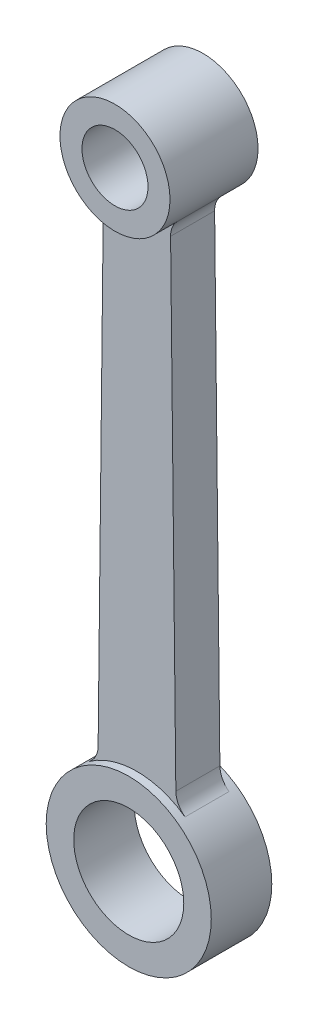
from build123d import *

# Parameters (mm, degrees)
SKETCH1_R           = 7.5
SKETCH1_R_2         = 5
BOSS_EXTRUDE1_DEPTH = 2.75
SKETCH2_R           = 5
SKETCH2_R_2         = 3
BOSS_EXTRUDE2_DEPTH = 4
BOSS_EXTRUDE3_DEPTH = 2
FILLET1_R           = 2


with BuildPart() as part:
    # Sketch1 → Boss-Extrude1 (new, symmetric)
    with BuildSketch(Plane.XY):
        Circle(SKETCH1_R)
        Circle(SKETCH1_R_2, mode=Mode.SUBTRACT)
    extrude(amount=BOSS_EXTRUDE1_DEPTH, both=True)



with BuildPart() as body_2:
    # Sketch2 → Boss-Extrude2 (new, symmetric)
    with BuildSketch(Plane.XY):
        with Locations((0, 56)):
            Circle(SKETCH2_R)
        with Locations((0, 56)):
            Circle(SKETCH2_R_2, mode=Mode.SUBTRACT)
    extrude(amount=BOSS_EXTRUDE2_DEPTH, both=True)


with BuildPart() as part_1:
    add(part.part)

    add(body_2.part)  # Boss-Extrude3 merges body 2
    # Sketch3 → Boss-Extrude3 (add, symmetric)
    with BuildSketch(Plane.XY):
        with BuildLine():
            Line((-3.043800059, 52.033227861), (-3.543272067, 6.610236233))
            ThreePointArc((-3.543272067, 6.610236233), (0, 7.5), (3.543272067, 6.610236233))
            Line((3.543272067, 6.610236233), (3.043800059, 52.033227861))
            ThreePointArc((3.043800059, 52.033227861), (0, 51), (-3.043800059, 52.033227861))
        make_face()
    extrude(amount=BOSS_EXTRUDE3_DEPTH, both=True)

    # Fillet1
    fillet1_edges = [part_1.edges().sort_by_distance(p)[0] for p in [
        (3.043800059, 52.033227861, 0),
        (-3.043800059, 52.033227861, 0),
        (-3.543272067, 6.610236233, 0),
        (3.543272067, 6.610236233, 0),
    ]]
    fillet(fillet1_edges, radius=FILLET1_R)


solid = part_1.part
